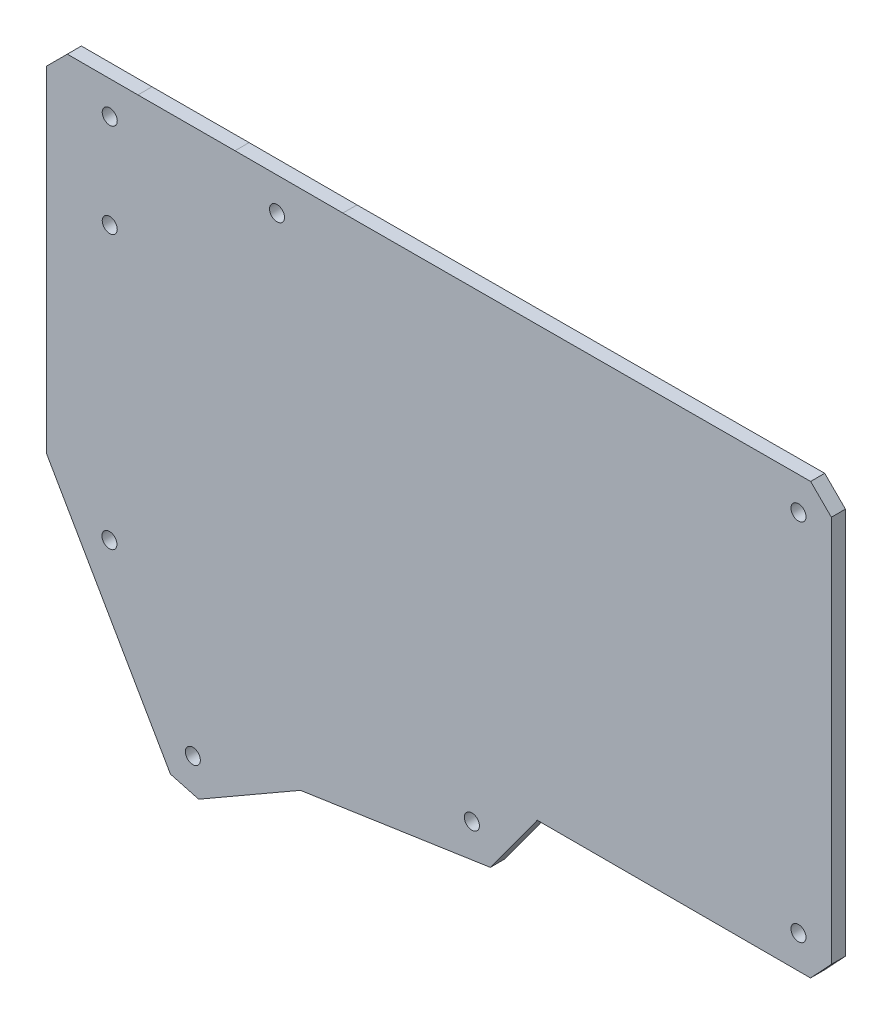
from build123d import *

# Parameters (mm, degrees)
ESQUISSE1_R        = 1.6
BOSS_EXTRU_1_DEPTH = 3


with BuildPart() as part:
    # Esquisse1 → Boss.-Extru.1 (new body)
    with BuildSketch(Plane.XY):
        Polygon((7.660893039, 1.267243786), (3.248846143, 5.665945076), (-96.367147031, 5.364168479), (-103.365175584, 5.364168479), (-119.344550333, 5.364168479), (-140.021777649, 5.320852512), (-155.064772313, 5.320852512), (-159.478985875, 0.90663895), (-159.478985875, -3.429484403), (-159.478985875, -70.574320891), (-133.100653393, -116.486520024), (-127.076613358, -118.11178196), (-105.412894174, -105.642711064), (-64.97062335, -99.631001274), (-54.971738012, -85.933633781), (3.227145703, -85.933633781), (7.660893039, -81.196072129), align=None)
        with Locations((-128.322250168, -110.752044388)):
            Circle(ESQUISSE1_R, mode=Mode.SUBTRACT)
        with Locations((-146.0923789, -79.822656053)):
            Circle(ESQUISSE1_R, mode=Mode.SUBTRACT)
        with Locations((-68.897334865, -93.137788223)):
            Circle(ESQUISSE1_R, mode=Mode.SUBTRACT)
        with Locations((0.660893039, -78.933633781)):
            Circle(ESQUISSE1_R, mode=Mode.SUBTRACT)
        with Locations((-146.02282508, -21.677868186)):
            Circle(ESQUISSE1_R, mode=Mode.SUBTRACT)
        with Locations((-146.02282508, -1.677868186)):
            Circle(ESQUISSE1_R, mode=Mode.SUBTRACT)
        with Locations((-110.397084988, -1.678365923)):
            Circle(ESQUISSE1_R, mode=Mode.SUBTRACT)
        with Locations((0.660893039, -1.341926987)):
            Circle(ESQUISSE1_R, mode=Mode.SUBTRACT)
    extrude(amount=BOSS_EXTRU_1_DEPTH)


solid = part.part
